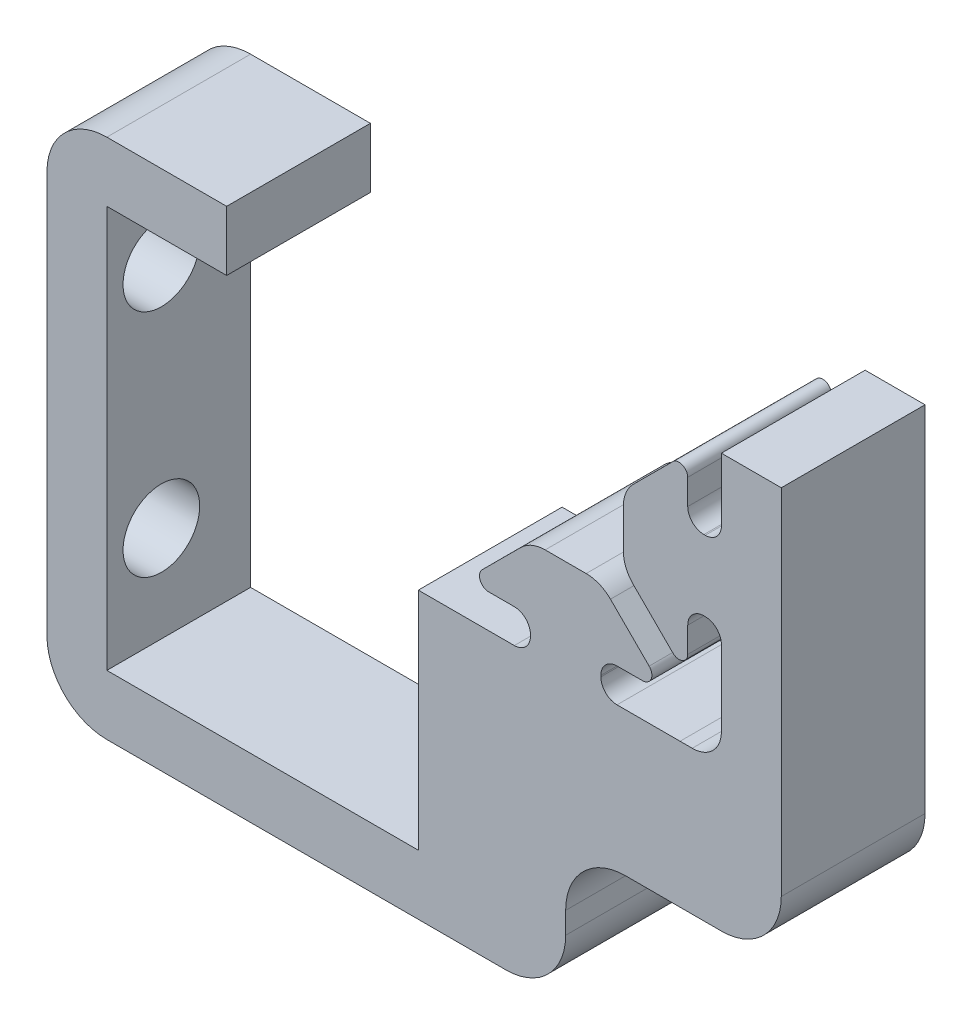
from build123d import *

# Parameters (mm, degrees)
BOSS_EXTRUDE1_DEPTH = 12
FILLET1_R           = 5
FILLET2_R           = 5
CUT_EXTRUDE1_REACH  = 74.499
SKETCH3_R           = 3.2
CHAMFER1_SIZE       = 0.2


with BuildPart() as part:
    # Sketch2 → Boss-Extrude1 (new body)
    with BuildSketch(Plane.XY):
        with BuildLine():
            Line((-10.5918, -13), (-5.317126718, -13))
            Line((-5.317126718, -13), (-4.287512407, -13))
            ThreePointArc((-4.287512407, -13), (-3.333616586, -12.604883414), (-2.9385, -11.650987593))
            Line((-2.9385, -11.650987593), (-2.9385, -11.539212407))
            ThreePointArc((-2.9385, -11.539212407), (-3.333616586, -10.585316586), (-4.287512407, -10.1902))
            Line((-4.287512407, -10.1902), (-6.416408329, -10.1902))
            ThreePointArc((-6.416408329, -10.1902), (-7.137514675, -9.708134418), (-6.967711912, -8.857517813))
            Line((-6.967711912, -8.857517813), (-3.740331666, -5.636015806))
            ThreePointArc((-3.740331666, -5.636015806), (-2.808257752, -5.01414519), (-1.709253557, -4.7958))
            Line((-1.709253557, -4.7958), (1.709253557, -4.7958))
            ThreePointArc((1.709253557, -4.7958), (2.808257752, -5.01414519), (3.740331666, -5.636015806))
            Line((3.740331666, -5.636015806), (6.967711912, -8.857517813))
            ThreePointArc((6.967711912, -8.857517813), (7.137514675, -9.708134418), (6.416408329, -10.1902))
            Line((6.416408329, -10.1902), (4.287512407, -10.1902))
            ThreePointArc((4.287512407, -10.1902), (3.333616586, -10.585316586), (2.9385, -11.539212407))
            Line((2.9385, -11.539212407), (2.9385, -11.650987593))
            ThreePointArc((2.9385, -11.650987593), (3.333616586, -12.604883414), (4.287512407, -13))
            Line((4.287512407, -13), (5.317126718, -13))
            Line((5.317126718, -13), (9.550465633, -13))
            Line((9.550465633, -13), (10.564722121, -12.999847763))
            ThreePointArc((10.564722121, -12.999847763), (12.294654751, -12.29465435), (12.999847757, -10.564721553))
            Line((12.999847757, -10.564721553), (13, -9.550422515))
            Line((13, -9.550422515), (13, -6.3330836))
            Line((13, -6.3330836), (13, -5.3170836))
            Line((13, -5.3170836), (13, -4.287469289))
            ThreePointArc((13, -4.287469289), (12.604883414, -3.333573468), (11.650987593, -2.938456882))
            Line((11.650987593, -2.938456882), (11.539212407, -2.938456882))
            ThreePointArc((11.539212407, -2.938456882), (10.585316586, -3.333573468), (10.1902, -4.287469289))
            Line((10.1902, -4.287469289), (10.1902, -6.402089023))
            ThreePointArc((10.1902, -6.402089023), (9.74154152, -7.073969797), (8.94902056, -6.917034355))
            Line((8.94902056, -6.917034355), (5.652895046, -3.628441884))
            ThreePointArc((5.652895046, -3.628441884), (5.027976112, -2.694919539), (4.8085, -1.593185507))
            Line((4.8085, -1.593185507), (4.8085, 1.593185507))
            ThreePointArc((4.8085, 1.593185507), (5.027976112, 2.694919539), (5.652895046, 3.628441884))
            Line((5.652895046, 3.628441884), (8.94902056, 6.917034355))
            ThreePointArc((8.94902056, 6.917034355), (9.74154152, 7.073969797), (10.1902, 6.402089023))
            Line((10.1902, 6.402089023), (10.1902, 4.287469289))
            ThreePointArc((10.1902, 4.287469289), (10.585316586, 3.333573468), (11.539212407, 2.938456882))
            Line((11.539212407, 2.938456882), (11.650987593, 2.938456882))
            ThreePointArc((11.650987593, 2.938456882), (12.604883414, 3.333573468), (13, 4.287469289))
            Line((13, 4.287469289), (13, 5.3170836))
            Line((13, 5.3170836), (13, 6.3330836))
            Line((13, 6.3330836), (13, 9.550422515))
            Line((13, 9.550422515), (18, 9.550422515))
            Line((18, 9.550422515), (18, -25))
            Line((18, -25), (0, -25))
            Line((0, -25), (0, -36.8026666))
            Line((0, -36.8026666), (-12, -36.8026666))
            Line((-12, -36.8026666), (-43.3, -36.8026666))
            Line((-43.3, -36.8026666), (-43.3, -31.8026666))
            Line((-43.3, -31.8026666), (-43.3, 6.7473334))
            Line((-43.3, 6.7473334), (-28.3, 6.7473334))
            Line((-28.3, 6.7473334), (-28.3, 1.7473334))
            Line((-28.3, 1.7473334), (-38.3, 1.7473334))
            Line((-38.3, 1.7473334), (-38.3, -31.8026666))
            Line((-38.3, -31.8026666), (-12.3, -31.8026666))
            Line((-12.3, -31.8026666), (-12.3, -13))
            Line((-12.3, -13), (-10.5918, -13))
        make_face()
    extrude(amount=BOSS_EXTRUDE1_DEPTH)

    # Fillet1
    fillet1_edges = [part.edges().sort_by_distance(p)[0] for p in [
        (0, -36.8026666, 6),
        (18, -25, 6),
        (0, -25, 6),
    ]]
    fillet(fillet1_edges, radius=FILLET1_R)

    # Fillet2
    fillet2_edges = [part.edges().sort_by_distance(p)[0] for p in [
        (-43.3, -36.8026666, 6),
        (-43.3, 6.7473334, 6),
    ]]
    fillet(fillet2_edges, radius=FILLET2_R)

    # Sketch3 → Cut-Extrude1 (cut, up to next)
    with BuildSketch(Plane.ZY.offset(43.3), mode=Mode.PRIVATE) as cut_extrude1_sk1:
        with Locations((7.45, -23.7926666)):
            Circle(SKETCH3_R)
    cut_extrude1_tool1 = extrude(cut_extrude1_sk1.sketch, amount=-CUT_EXTRUDE1_REACH, mode=Mode.PRIVATE) & part.part
    # Sketch3 → Cut-Extrude1 (cut, up to next)
    with BuildSketch(Plane.ZY.offset(43.3), mode=Mode.PRIVATE) as cut_extrude1_sk2:
        with Locations((7.45, -4.5926666)):
            Circle(SKETCH3_R)
    cut_extrude1_tool2 = extrude(cut_extrude1_sk2.sketch, amount=-CUT_EXTRUDE1_REACH, mode=Mode.PRIVATE) & part.part
    add(cut_extrude1_tool1.solids().sort_by_distance((-43.3, -23.792667, 7.45))[0], mode=Mode.SUBTRACT)
    add(cut_extrude1_tool2.solids().sort_by_distance((-43.3, -4.592667, 7.45))[0], mode=Mode.SUBTRACT)

    # Chamfer1
    chamfer1_edges = [part.edges().sort_by_distance(p)[0] for p in [
        (-43.3, -23.7926666, 4.25),
        (-43.3, -4.5926666, 4.25),
    ]]
    chamfer(chamfer1_edges, length=CHAMFER1_SIZE)


solid = part.part
